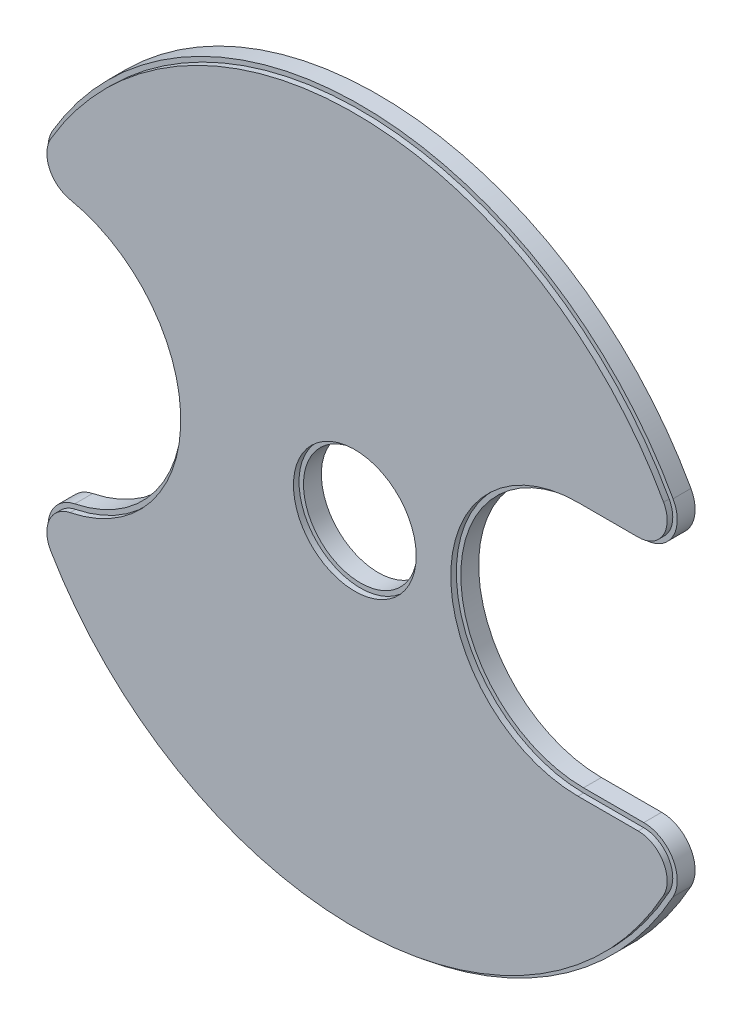
from build123d import *

# Parameters (mm, degrees)
ESQUISSE1_R        = 5.1
BOSS_EXTRU_1_DEPTH = 1.6
CONG_1_R           = 3
ESQUISSE2_R        = 5.5
BOSS_EXTRU_2_DEPTH = 0.5


with BuildPart() as part:
    # Esquisse1 → Boss.-Extru.1 (new body)
    with BuildSketch(Plane.XY):
        with BuildLine():
            Line((30.049958403, 11), (20, 11))
            ThreePointArc((20, 11), (9, 0), (20, -11))
            Line((20, -11), (30.049958403, -11))
            ThreePointArc((30.049958403, -11), (0.469484965, -31.996555813), (-29.714285714, -11.876919823))
            ThreePointArc((-29.714285714, -11.876919823), (-16, 0), (-29.714285714, 11.876919823))
            ThreePointArc((-29.714285714, 11.876919823), (0.469484965, 31.996555813), (30.049958403, 11))
        make_face()
        Circle(ESQUISSE1_R, mode=Mode.SUBTRACT)
    extrude(amount=BOSS_EXTRU_1_DEPTH)

    # Congé1
    cong_1_edges = [part.edges().sort_by_distance(p)[0] for p in [
        (30.049958403, 11, 0.8),
        (30.049958403, -11, 0.8),
        (-29.714285714, -11.876919823, 0.8),
        (-29.714285714, 11.876919823, 0.8),
    ]]
    fillet(cong_1_edges, radius=CONG_1_R)

    # Esquisse2 → Boss.-Extru.2 (add)
    with BuildSketch(Plane.XY.offset(1.6)):
        with BuildLine():
            Line((20, 11.4), (25.396850198, 11.4))
            ThreePointArc((25.396850198, 11.4), (27.635538238, 12.677776168), (27.673809182, 15.255172414))
            ThreePointArc((27.673809182, 15.255172414), (0.43695488, 31.596978818), (-27.24137931, 16.014595008))
            ThreePointArc((-27.24137931, 16.014595008), (-27.375100724, 13.639159391), (-25.52, 12.149469124))
            ThreePointArc((-25.52, 12.149469124), (-15.6, 0), (-25.52, -12.149469124))
            ThreePointArc((-25.52, -12.149469124), (-27.375100724, -13.639159391), (-27.24137931, -16.014595008))
            ThreePointArc((-27.24137931, -16.014595008), (0.43695488, -31.596978818), (27.673809182, -15.255172414))
            ThreePointArc((27.673809182, -15.255172414), (27.635538238, -12.677776168), (25.396850198, -11.4))
            Line((25.396850198, -11.4), (20, -11.4))
            ThreePointArc((20, -11.4), (8.6, 0), (20, 11.4))
        make_face()
        Circle(ESQUISSE2_R, mode=Mode.SUBTRACT)
    extrude(amount=BOSS_EXTRU_2_DEPTH)


solid = part.part
